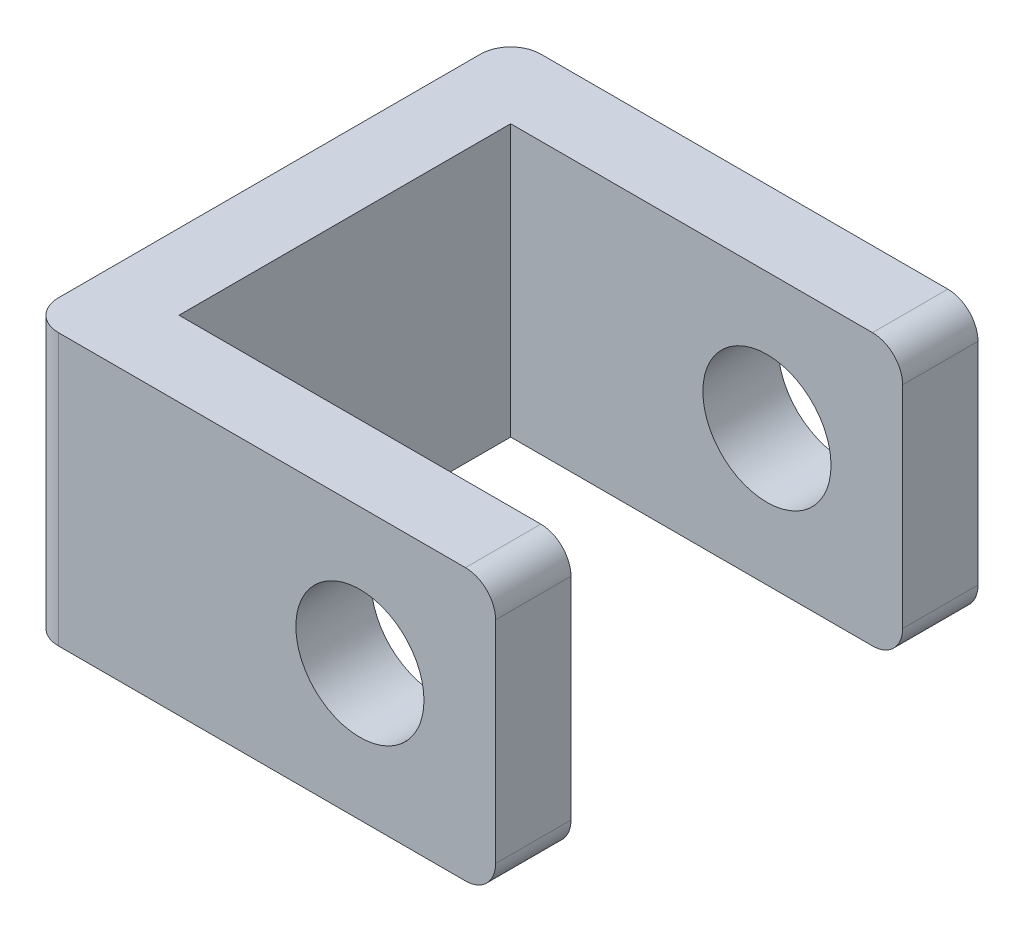
from build123d import *

# Parameters (mm, degrees)
EXTRUDE_1_DEPTH     = 18
FILLET_1_R          = 2
SKETCH_2_R          = 4.25
CUT_EXTRUDE_1_DEPTH = 49.052055107


with BuildPart() as part:
    # Эскиз1 → Бобышка-Вытянуть1 (new body)
    with BuildSketch(Plane(origin=(0, 0, 0), x_dir=(1, 0, 0), z_dir=(0, 1, 0))):
        with BuildLine():
            Line((0, 14), (0, -14))
            ThreePointArc((0, -14), (0.585786438, -15.414213562), (2, -16))
            Line((2, -16), (31, -16))
            Line((31, -16), (31, -11))
            Line((31, -11), (5, -11))
            Line((5, -11), (5, 11))
            Line((5, 11), (31, 11))
            Line((31, 11), (31, 16))
            Line((31, 16), (2, 16))
            ThreePointArc((2, 16), (0.585786438, 15.414213562), (0, 14))
        make_face()
    extrude(amount=EXTRUDE_1_DEPTH)

    # Скругление1
    fillet_1_edges = [part.edges().sort_by_distance(p)[0] for p in [
        (31, 18, 13.5),
        (31, 0, -13.5),
        (31, 0, 13.5),
        (31, 18, -13.5),
    ]]
    fillet(fillet_1_edges, radius=FILLET_1_R)

    # Эскиз2 → Вырез-Вытянуть1 (cut, through all)
    with BuildSketch(Plane.XY.offset(16)):
        with Locations((22, 9)):
            Circle(SKETCH_2_R)
    extrude(amount=-CUT_EXTRUDE_1_DEPTH, mode=Mode.SUBTRACT)


solid = part.part
